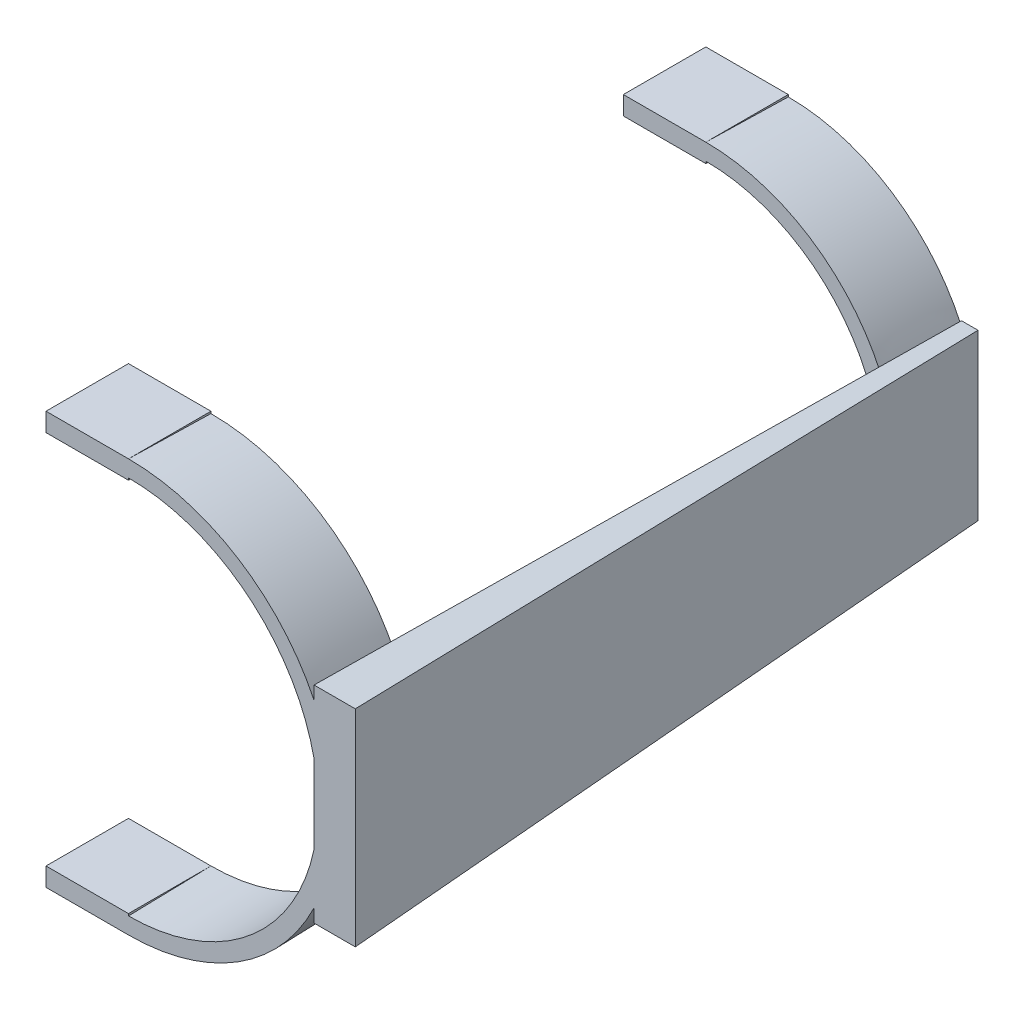
from build123d import *

# Parameters (mm, degrees)
REVOLVE_1_ANGLE     = 180
SKETCH_2_W          = 120
SKETCH_2_H          = 124.466444362
CUT_EXTRUDE_1_DEPTH = 175.928556845
SKETCH_6_W          = 20
SKETCH_6_H          = 4.5
EXTRUDE_1_DEPTH     = 20


with BuildPart() as part:
    # 草图1 → 旋转1 (revolve)
    with BuildSketch(Plane(origin=(0, 0, 0), x_dir=(0, 0, -1), z_dir=(1, 0, 0))):
        Polygon((0, 50), (0, 46), (160, 42), (160, 46), align=None)
    revolve(axis=Axis((0, 0, 0), (0, 0, -1)), revolution_arc=REVOLVE_1_ANGLE)

    # 草图2 → 切除-拉伸1 (cut, through all)
    with BuildSketch(Plane(origin=(0, 0, 0), x_dir=(0, 0, -1), z_dir=(1, 0, 0))):
        with Locations((80, -2.118201403)):
            Rectangle(SKETCH_2_W, SKETCH_2_H)
    extrude(amount=CUT_EXTRUDE_1_DEPTH, mode=Mode.SUBTRACT)


with BuildPart() as cut_extrude_1_piece_1:
    # of the separate pieces the step leaves, piece 1, a body of its own (cut_extrude_1_pieces)
    add(part.part.solids().sort_by_distance((0, 50, 0))[0])



with BuildPart() as cut_extrude_1_piece_2:
    # of the separate pieces the step leaves, piece 2, a body of its own (cut_extrude_1_pieces)
    add(part.part.solids().sort_by_distance((0, 46, -160))[0])


with BuildPart() as cut_extrude_1_piece_1_1:
    add(cut_extrude_1_piece_1.part)

    add(cut_extrude_1_piece_2.part)  # 放样1 merges 切除-拉伸1 piece 2
    # 草图3 → 放样1 section 0
    with BuildSketch(Plane.XY):
        with BuildLine():
            Line((55, 25), (45, 25))
            Line((45, 25), (45, -25))
            Line((45, -25), (55, -25))
            Line((55, -25), (55, 25))
        make_face()
    # 草图4 → 放样1 section 1
    with BuildSketch(Plane(origin=(0, 0, -160), x_dir=(-1, 0, 0), z_dir=(0, 0, -1))):
        with BuildLine():
            Line((-46, 20), (-42, 20))
            Line((-42, 20), (-42, -20))
            Line((-42, -20), (-46, -20))
            Line((-46, -20), (-46, 20))
        make_face()
    loft()

    # 草图6 → 凸台-拉伸1 (add)
    with BuildSketch(Plane.ZY):
        with Locations((-10, 47.75)):
            Rectangle(SKETCH_6_W, SKETCH_6_H)
        with Locations((-10, -47.75)):
            Rectangle(SKETCH_6_W, SKETCH_6_H)
        with Locations((-150, -44.25)):
            Rectangle(SKETCH_6_W, SKETCH_6_H)
        with Locations((-150, 44.25)):
            Rectangle(SKETCH_6_W, SKETCH_6_H)
    extrude(amount=EXTRUDE_1_DEPTH)


solid = cut_extrude_1_piece_1_1.part
